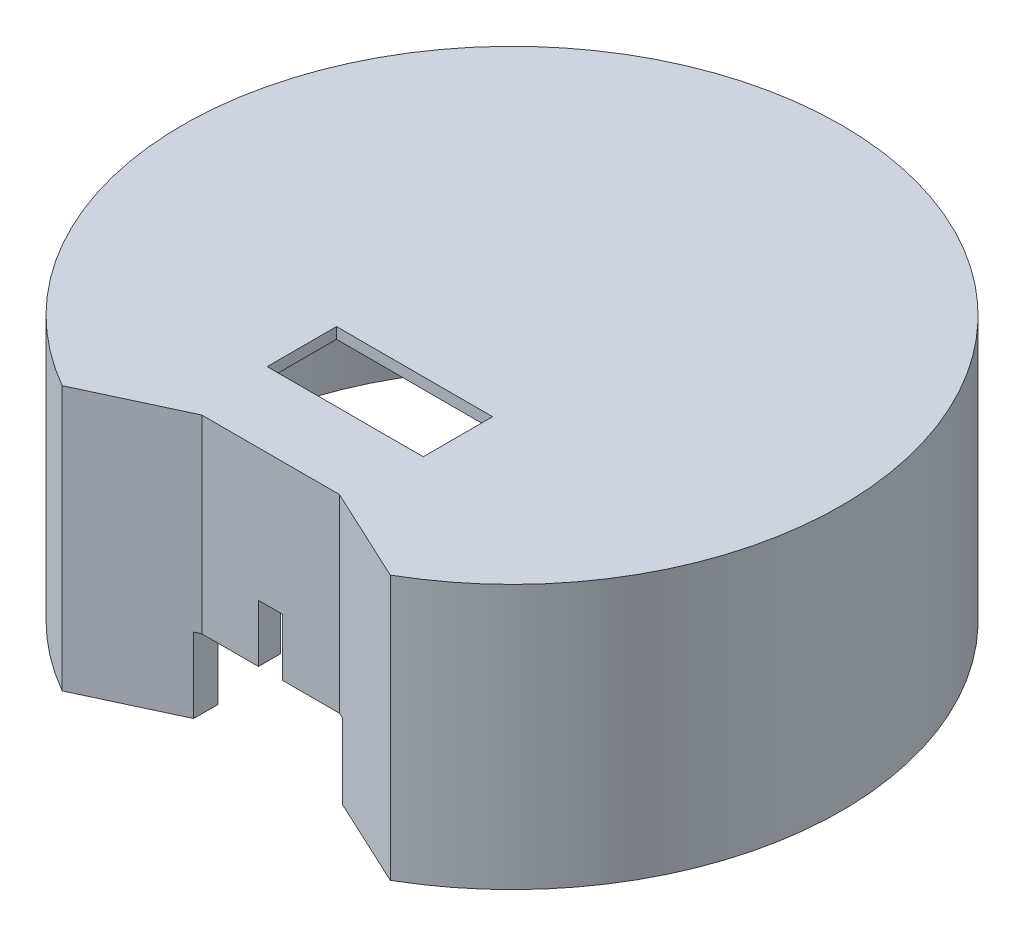
from build123d import *

# Parameters (mm, degrees)
BOSS_EXTRUDE1_DEPTH     = 152.4
SHELL2_T                = -12.7
CUT_EXTRUDE1_DEPTH      = 43.175
CUT_EXTRUDE2_DEPTH      = 309.910601955
CUT_EXTRUDE2_DEPTH_BACK = 309.910601955
SKETCH3_W               = 90
SKETCH3_H               = 40
SKETCH4_W               = 13.97
SKETCH4_H               = 33.025
CUT_EXTRUDE3_DEPTH      = 12.7
SKETCH5_W               = 90
SKETCH5_H               = 40
CUT_EXTRUDE4_DEPTH      = 6.35


with BuildPart() as part:
    # Sketch1 → Boss-Extrude1 (new body)
    with BuildSketch(Plane(origin=(0, 0, 0), x_dir=(1, 0, 0), z_dir=(0, 1, 0))):
        with BuildLine():
            Line((-39.6875, -139.2), (39.6875, -139.2))
            Line((39.6875, -139.2), (94.570201191, -164.792223866))
            ThreePointArc((94.570201191, -164.792223866), (0, 190), (-94.570201191, -164.792223866))
            Line((-94.570201191, -164.792223866), (-39.6875, -139.2))
        make_face()
    extrude(amount=BOSS_EXTRUDE1_DEPTH)

    # Shell2
    shell2_openings = [part.faces().sort_by_distance(p)[0] for p in [
        (0, 0, -10.230254614),
    ]]
    offset(amount=SHELL2_T, openings=shell2_openings, kind=Kind.INTERSECTION)

    # Sketch2 → Cut-Extrude1 (cut)
    with BuildSketch(Plane.XZ):
        Polygon((-42.503022216, 126.5), (42.503022216, 126.5), (42.8625, 126.667627244), (42.8625, 140.680526815), (39.6875, 139.2), (-39.6875, 139.2), (-42.8625, 140.680526815), (-42.8625, 126.667627244), align=None)
    extrude(amount=-CUT_EXTRUDE1_DEPTH, mode=Mode.SUBTRACT)

    # Sketch3 → Cut-Extrude2 (cut, two sides: drawn at the far end of the back side and taken through both)
    with BuildSketch(Plane(origin=(0, 152.4, 0), x_dir=(1, 0, 0), z_dir=(0, 1, 0)).offset(-CUT_EXTRUDE2_DEPTH_BACK)):
        with Locations((0, -76.2)):
            Rectangle(SKETCH3_W, SKETCH3_H)
    extrude(amount=CUT_EXTRUDE2_DEPTH + CUT_EXTRUDE2_DEPTH_BACK, mode=Mode.SUBTRACT)

    # Sketch4 → Cut-Extrude3 (cut)
    with BuildSketch(Plane.XY.offset(139.2)):
        with Locations((0, 59.6875)):
            Rectangle(SKETCH4_W, SKETCH4_H)
    extrude(amount=-CUT_EXTRUDE3_DEPTH, mode=Mode.SUBTRACT)

    # Sketch5 → Cut-Extrude4 (cut)
    with BuildSketch(Plane.XZ.offset(-139.7)):
        with BuildLine():
            Line((42.503022216, 126.5), (-42.503022216, 126.5))
            Line((-42.503022216, 126.5), (-93.832389801, 150.435277193))
            ThreePointArc((-93.832389801, 150.435277193), (0, -177.3), (93.832389801, 150.435277193))
            Line((93.832389801, 150.435277193), (42.503022216, 126.5))
        make_face()
        with Locations((0, 76.2)):
            Rectangle(SKETCH5_W, SKETCH5_H, mode=Mode.SUBTRACT)
    extrude(amount=-CUT_EXTRUDE4_DEPTH, mode=Mode.SUBTRACT)


solid = part.part
